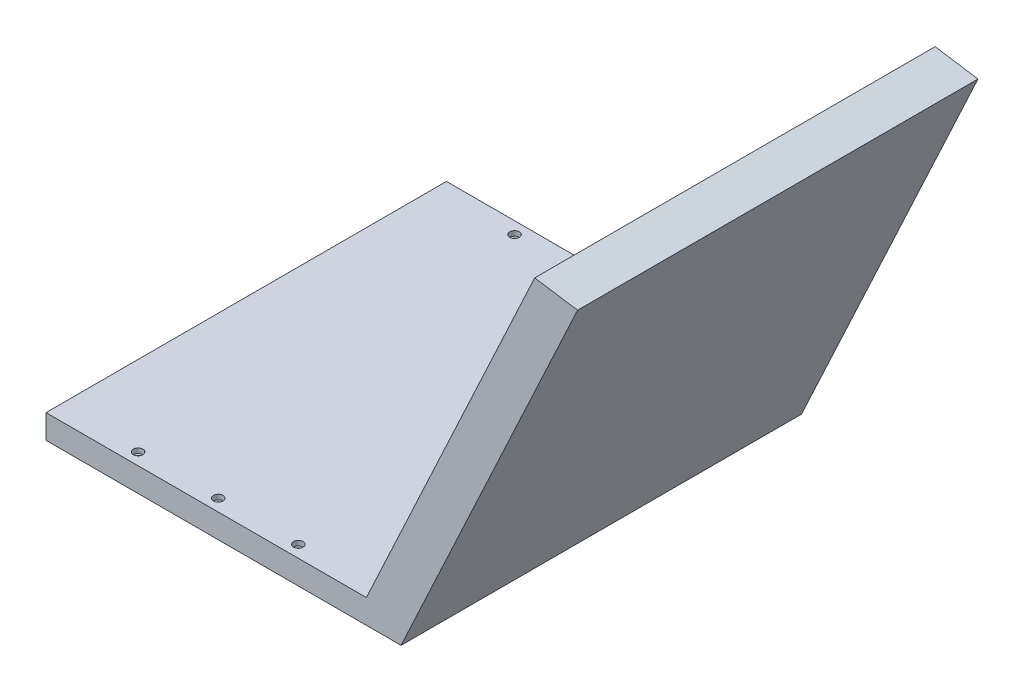
from build123d import *

# Parameters (mm, degrees)
BOSS_EXTRUDE2_DEPTH = 250
SKETCH5_R           = 6
CUT_EXTRUDE1_DEPTH  = 6
SKETCH6_R           = 3
CUT_EXTRUDE2_DEPTH  = 684.91866463


with BuildPart() as part:
    # Sketch2 → Boss-Extrude2 (new, symmetric)
    with BuildSketch(Plane.XY):
        Polygon((0, 0), (-443.349160121, 0), (-443.349160121, 30), (-43.349160121, 30), (166.872551321, 480.821915028), (220.358608676, 472.5605613), align=None)
    extrude(amount=BOSS_EXTRUDE2_DEPTH, both=True)

    # Sketch5 → Cut-Extrude1 (cut)
    with BuildSketch(Plane(origin=(0, 30, 0), x_dir=(1, 0, 0), z_dir=(0, 1, 0))):
        with Locations(Location((-343.349160121, -235, 0), (0, 0, 270))):
            Circle(SKETCH5_R)
        with Locations(Location((-243.349160121, -235, 0), (0, 0, 270))):
            Circle(SKETCH5_R)
        with Locations(Location((-143.349160121, -235, 0), (0, 0, 270))):
            Circle(SKETCH5_R)
        with Locations(Location((-143.349160121, 235, 0), (0, 0, 90))):
            Circle(SKETCH5_R)
        with Locations(Location((-243.349160121, 235, 0), (0, 0, 90))):
            Circle(SKETCH5_R)
        with Locations(Location((-343.349160121, 235, 0), (0, 0, 90))):
            Circle(SKETCH5_R)
    extrude(amount=-CUT_EXTRUDE1_DEPTH, mode=Mode.SUBTRACT)

    # Sketch6 → Cut-Extrude2 (cut, through all)
    with BuildSketch(Plane(origin=(0, 24, 0), x_dir=(1, 0, 0), z_dir=(0, 1, 0))):
        with Locations(Location((-143.349160121, 235, 0), (0, 0, 270))):
            Circle(SKETCH6_R)
        with Locations(Location((-243.349160121, 235, 0), (0, 0, 270))):
            Circle(SKETCH6_R)
        with Locations(Location((-343.349160121, 235, 0), (0, 0, 270))):
            Circle(SKETCH6_R)
        with Locations(Location((-343.349160121, -235, 0), (0, 0, 270))):
            Circle(SKETCH6_R)
        with Locations(Location((-243.349160121, -235, 0), (0, 0, 270))):
            Circle(SKETCH6_R)
        with Locations(Location((-143.349160121, -235, 0), (0, 0, 270))):
            Circle(SKETCH6_R)
    extrude(amount=-CUT_EXTRUDE2_DEPTH, mode=Mode.SUBTRACT)


solid = part.part
